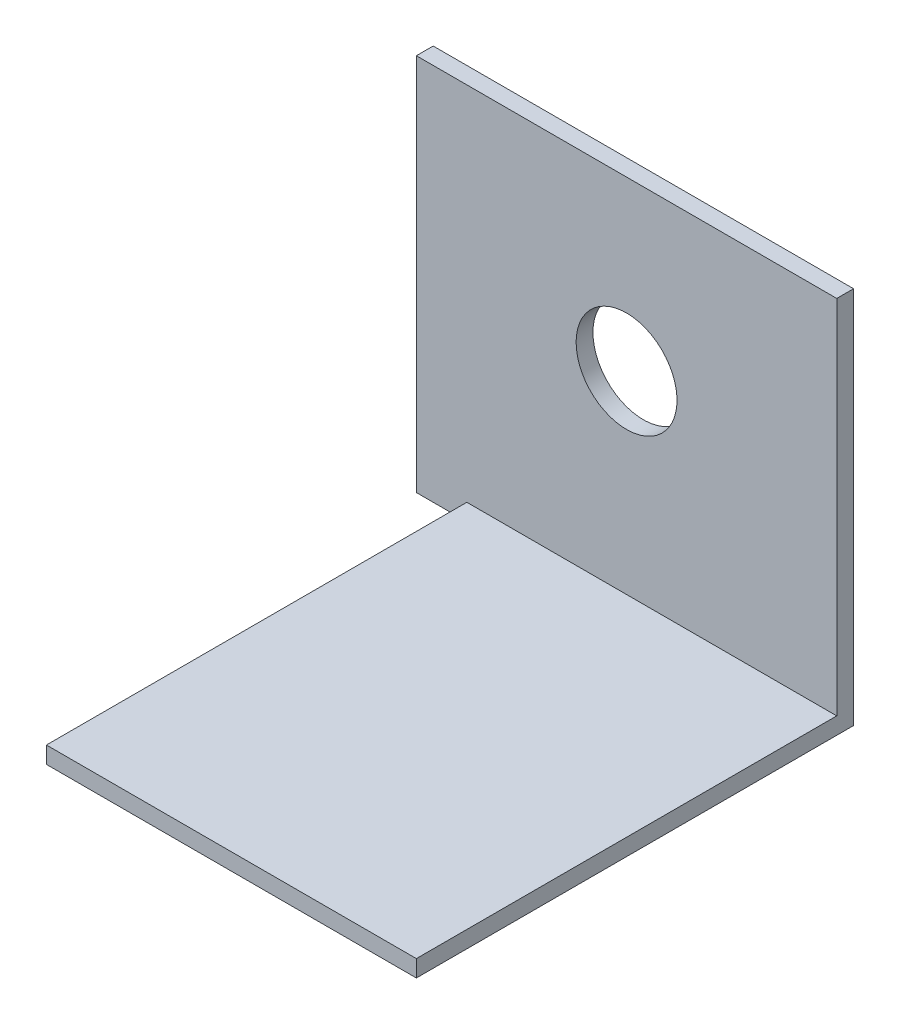
from build123d import *

# Parameters (mm, degrees)
SKETCH1_W           = 44
SKETCH1_H           = 50
BOSS_EXTRUDE1_DEPTH = 2
SKETCH2_W           = 50
SKETCH2_H           = 45
SKETCH2_R           = 6
BOSS_EXTRUDE2_DEPTH = 2


with BuildPart() as part:
    # Sketch1 → Boss-Extrude1 (new body)
    with BuildSketch(Plane(origin=(0, 0, 0), x_dir=(1, 0, 0), z_dir=(0, 1, 0))):
        with Locations((22, -25)):
            Rectangle(SKETCH1_W, SKETCH1_H)
    extrude(amount=BOSS_EXTRUDE1_DEPTH)

    # Sketch2 → Boss-Extrude2 (add)
    with BuildSketch(Plane(origin=(0, 0, 0), x_dir=(-1, 0, 0), z_dir=(0, 0, -1))):
        with Locations((-19, 22.5)):
            Rectangle(SKETCH2_W, SKETCH2_H)
        with Locations((-19, 25)):
            Circle(SKETCH2_R, mode=Mode.SUBTRACT)
    extrude(amount=BOSS_EXTRUDE2_DEPTH)


solid = part.part
